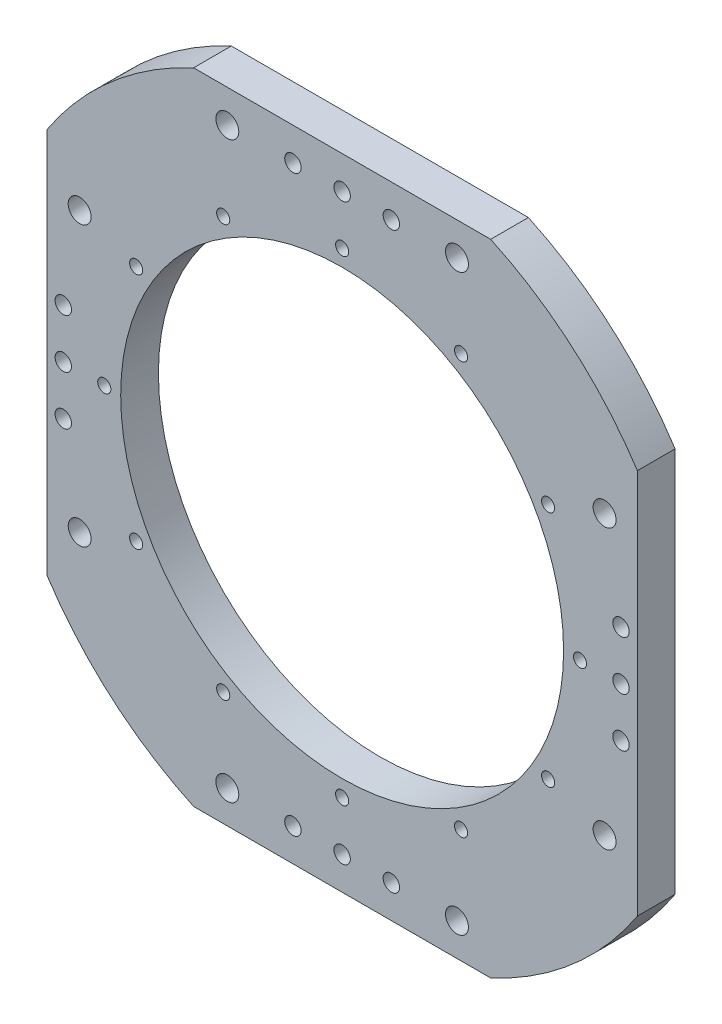
from build123d import *

# Parameters (mm, degrees)
SKETCH_1_W           = 360
SKETCH_1_H           = 390
EXTRUDE_1_DEPTH      = 23
SKETCH_2_R           = 135
CUT_EXTRUDE_1_DEPTH  = 30
CHAMFER_1_SIZE       = 20
SKETCH_5_R           = 4
CUT_EXTRUDE_2_DEPTH  = 35
SKETCH_6_R           = 7
CUT_EXTRUDE_3_DEPTH  = 35
SKETCH_11_OUTSIDE_W  = 468.25
SKETCH_11_OUTSIDE_H  = 498.25
SKETCH_11_OUTSIDE_R  = 215
CUT_EXTRUDE_8_DEPTH  = 284.776320365
SKETCH_12_R          = 5
CUT_EXTRUDE_9_DEPTH  = 28
SKETCH_13_R          = 5
CUT_EXTRUDE_10_DEPTH = 284.776320365
SKETCH_15_R          = 5
CUT_EXTRUDE_11_DEPTH = 28


with BuildPart() as part:
    # 草图1 → 拉伸1 (new body)
    with BuildSketch(Plane.XY):
        with Locations((-20, 5)):
            Rectangle(SKETCH_1_W, SKETCH_1_H)
    extrude(amount=EXTRUDE_1_DEPTH)

    # 草图2 → 切除-拉伸1 (cut)
    with BuildSketch(Plane.XY.offset(23)):
        with Locations((-20, 5)):
            Circle(SKETCH_2_R)
    extrude(amount=-CUT_EXTRUDE_1_DEPTH, mode=Mode.SUBTRACT)

    # 倒角1
    chamfer_1_edges = [part.edges().sort_by_distance(p)[0] for p in [
        (-200, 200, 11.5),
        (160, 200, 11.5),
        (160, -190, 11.5),
        (-200, -190, 11.5),
    ]]
    chamfer(chamfer_1_edges, length=CHAMFER_1_SIZE)

    # 草图5 → 切除-拉伸2 (cut)
    with BuildSketch(Plane.XY.offset(23)):
        with Locations((52.5, 130.573683549)):
            Circle(SKETCH_5_R)
        with Locations((-20, 150)):
            Circle(SKETCH_5_R)
        with Locations((105.573683549, 77.5)):
            Circle(SKETCH_5_R)
        with Locations((125, 5)):
            Circle(SKETCH_5_R)
        with Locations((105.573683549, -67.5)):
            Circle(SKETCH_5_R)
        with Locations((52.5, -120.573683549)):
            Circle(SKETCH_5_R)
        with Locations((-20, -140)):
            Circle(SKETCH_5_R)
        with Locations((-92.5, -120.573683549)):
            Circle(SKETCH_5_R)
        with Locations((-145.573683549, -67.5)):
            Circle(SKETCH_5_R)
        with Locations((-165, 5)):
            Circle(SKETCH_5_R)
        with Locations((-145.573683549, 77.5)):
            Circle(SKETCH_5_R)
        with Locations((-92.5, 130.573683549)):
            Circle(SKETCH_5_R)
    extrude(amount=-CUT_EXTRUDE_2_DEPTH, mode=Mode.SUBTRACT)

    # 草图6 → 切除-拉伸3 (cut)
    with BuildSketch(Plane.XY.offset(23)):
        with Locations((140, -80)):
            Circle(SKETCH_6_R)
        with Locations((50, 180)):
            Circle(SKETCH_6_R)
        with Locations((140, -155)):
            Circle(SKETCH_6_R)
        with Locations((-90, 180)):
            Circle(SKETCH_6_R)
        with Locations((140, 165)):
            Circle(SKETCH_6_R)
        with Locations((140, 90)):
            Circle(SKETCH_6_R)
        with Locations((50, -170)):
            Circle(SKETCH_6_R)
        with Locations((-90, -170)):
            Circle(SKETCH_6_R)
        with Locations((-180, 90)):
            Circle(SKETCH_6_R)
        with Locations((-180, 165)):
            Circle(SKETCH_6_R)
        with Locations((-180, -155)):
            Circle(SKETCH_6_R)
        with Locations((-180, -80)):
            Circle(SKETCH_6_R)
    extrude(amount=-CUT_EXTRUDE_3_DEPTH, mode=Mode.SUBTRACT)

    # 草图11 outside → 切除-拉伸8 (cut, through all)
    with BuildSketch(Plane.XY.offset(23)):
        with Locations((-20, 5)):
            Rectangle(SKETCH_11_OUTSIDE_W, SKETCH_11_OUTSIDE_H)
        with Locations((-20, 5)):
            Circle(SKETCH_11_OUTSIDE_R, mode=Mode.SUBTRACT)
    extrude(amount=-CUT_EXTRUDE_8_DEPTH, mode=Mode.SUBTRACT)

    # 草图12 → 切除-拉伸9 (cut)
    with BuildSketch(Plane.XY.offset(23)):
        with Locations((-50, 180)):
            Circle(SKETCH_12_R)
        with Locations((10, 180)):
            Circle(SKETCH_12_R)
        with Locations((10, -170)):
            Circle(SKETCH_12_R)
        with Locations((-50, -170)):
            Circle(SKETCH_12_R)
    extrude(amount=-CUT_EXTRUDE_9_DEPTH, mode=Mode.SUBTRACT)

    # 草图13 → 切除-拉伸10 (cut, through all)
    with BuildSketch(Plane.XY.offset(23)):
        with Locations((-20, 180)):
            Circle(SKETCH_13_R)
        with Locations(Location((-20, -170, 0), (0, 0, 180))):
            Circle(SKETCH_13_R)
    extrude(amount=-CUT_EXTRUDE_10_DEPTH, mode=Mode.SUBTRACT)

    # 草图15 → 切除-拉伸11 (cut)
    with BuildSketch(Plane.XY.offset(23)):
        with Locations((-190, 35)):
            Circle(SKETCH_15_R)
        with Locations((150, -25)):
            Circle(SKETCH_15_R)
        with Locations((-190, 5)):
            Circle(SKETCH_15_R)
        with Locations((-190, -25)):
            Circle(SKETCH_15_R)
        with Locations((150, 5)):
            Circle(SKETCH_15_R)
        with Locations((150, 35)):
            Circle(SKETCH_15_R)
    extrude(amount=-CUT_EXTRUDE_11_DEPTH, mode=Mode.SUBTRACT)


solid = part.part
